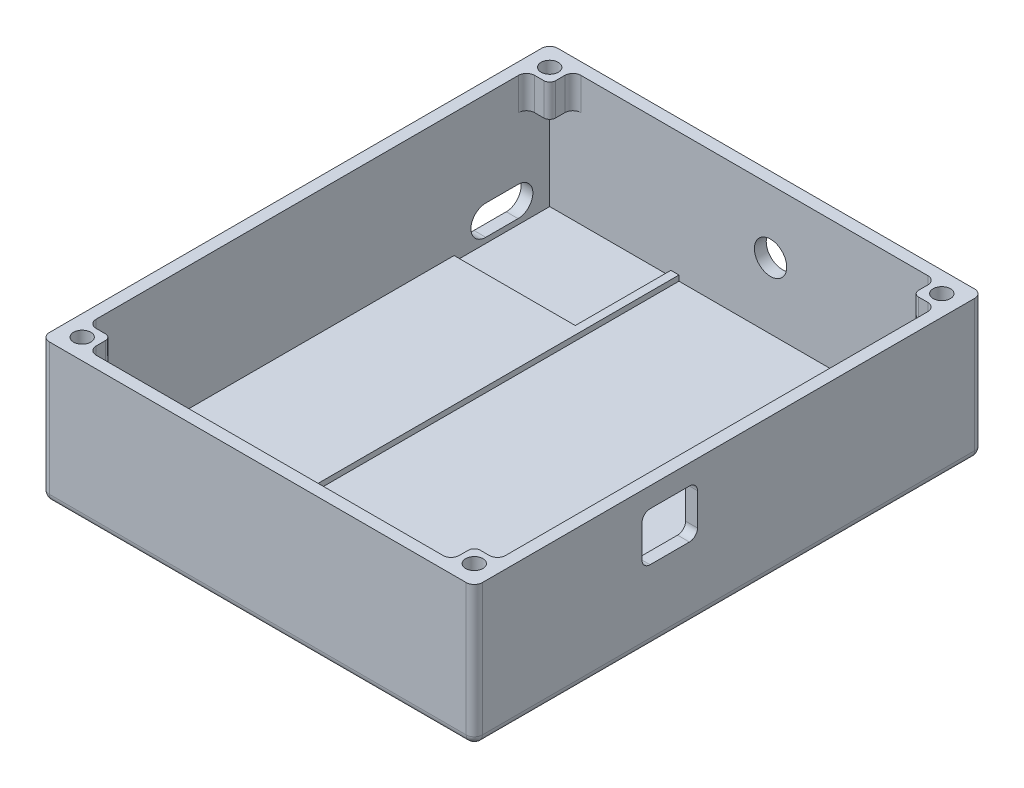
from build123d import *

# Parameters (mm, degrees)
SKETCH1_W           = 22.5
SKETCH1_H           = 17.75
SKETCH1_W_2         = 52
SKETCH1_H_2         = 71.85
BOSS_EXTRUDE1_DEPTH = 2
BOSS_EXTRUDE2_DEPTH = 3
SKETCH1_4_W         = 80.4
SKETCH1_4_H         = 94.4
SKETCH1_4_W_2       = 76
SKETCH1_4_H_2       = 90
BOSS_EXTRUDE3_DEPTH = 26
BOSS_EXTRUDE4_DEPTH = 78.2
CUT_EXTRUDE1_START  = -78.2
SKETCH2_3_W         = 10.3
SKETCH2_3_H         = 9
CUT_EXTRUDE1_DEPTH  = 26
CUT_EXTRUDE2_DEPTH  = 26
FILLET1_R           = 1.5
SKETCH4_R           = 3
CUT_EXTRUDE3_DEPTH  = 26
SKETCH5_R           = 1.6
BOSS_EXTRUDE5_DEPTH = 6
FILLET2_R           = 1.5


with BuildPart() as part:
    # Sketch1 → Boss-Extrude1 (new body)
    with BuildSketch(Plane(origin=(0, 0, 0), x_dir=(1, 0, 0), z_dir=(0, 1, 0))):
        Polygon((-38, -26.85), (-14, -26.85), (-14, 45), (-15.5, 45), (-15.5, 27.25), (-38, 27.25), align=None)
        with Locations((-26.75, 36.125)):
            Rectangle(SKETCH1_W, SKETCH1_H)
        with Locations((12, 9.075)):
            Rectangle(SKETCH1_W_2, SKETCH1_H_2)
        Polygon((38, -45), (38, -26.85), (-14, -26.85), (-38, -26.85), (-38, -45), align=None)
    extrude(amount=BOSS_EXTRUDE1_DEPTH)

    # Sketch1<3> → Boss-Extrude2 (add)
    with BuildSketch(Plane(origin=(0, 0, 0), x_dir=(1, 0, 0), z_dir=(0, 1, 0))):
        Polygon((-38, -26.85), (-14, -26.85), (-14, 45), (-15.5, 45), (-15.5, 27.25), (-38, 27.25), align=None)
    extrude(amount=BOSS_EXTRUDE2_DEPTH)

    # Sketch1<4> → Boss-Extrude3 (add)
    with BuildSketch(Plane(origin=(0, 0, 0), x_dir=(1, 0, 0), z_dir=(0, 1, 0))):
        Rectangle(SKETCH1_4_W, SKETCH1_4_H)
        Rectangle(SKETCH1_4_W_2, SKETCH1_4_H_2, mode=Mode.SUBTRACT)
    extrude(amount=BOSS_EXTRUDE3_DEPTH)

    # Sketch2 → Boss-Extrude4 (add)
    with BuildSketch(Plane.ZY.offset(40.2)):
        with BuildLine():
            Line((28.764343606, 5.5), (26.964343606, 5.5))
            Line((26.964343606, 5.5), (26.964343606, 0))
            Line((26.964343606, 0), (41.904953918, 0))
            Line((41.904953918, 0), (47.2, 0))
            Line((47.2, 0), (47.2, 5.5375))
            Line((47.2, 5.5375), (45, 5.5375))
            Line((45, 5.5375), (43.114695317, 5.5375))
            ThreePointArc((43.114695317, 5.5375), (35.948714495, 2.000030985), (28.764343606, 5.5))
        make_face()
    extrude(amount=-BOSS_EXTRUDE4_DEPTH)

    # Sketch2<3> → Cut-Extrude1 (cut)
    with BuildSketch(Plane.ZY.offset(40.2).offset(CUT_EXTRUDE1_START)):
        with Locations((10.914343606, 17.8)):
            Rectangle(SKETCH2_3_W, SKETCH2_3_H)
    extrude(amount=-CUT_EXTRUDE1_DEPTH, mode=Mode.SUBTRACT)

    # Sketch3 → Cut-Extrude2 (cut)
    with BuildSketch(Plane.ZY.offset(40.2)):
        with BuildLine():
            Line((-39.125, 8.5), (-33.125, 8.5))
            ThreePointArc((-33.125, 8.5), (-30.375, 5.75), (-33.125, 3))
            Line((-33.125, 3), (-39.125, 3))
            ThreePointArc((-39.125, 3), (-41.875, 5.75), (-39.125, 8.5))
        make_face()
    extrude(amount=-CUT_EXTRUDE2_DEPTH, mode=Mode.SUBTRACT)

    # Fillet1
    fillet1_edges = [part.edges().sort_by_distance(p)[0] for p in [
        (39.1, 22.3, 16.064343606),
        (39.1, 13.3, 16.064343606),
        (39.1, 13.3, 5.764343606),
        (39.1, 22.3, 5.764343606),
        (0, 0, 47.2),
        (-40.2, 13, 47.2),
        (40.2, 0, 0),
        (40.2, 13, 47.2),
        (40.2, 13, -47.2),
        (-40.2, 13, -47.2),
        (-40.2, 0, 0),
        (0, 0, -47.2),
    ]]
    fillet(fillet1_edges, radius=FILLET1_R)

    # Sketch4 → Cut-Extrude3 (cut)
    with BuildSketch(Plane(origin=(0, 0, -47.2), x_dir=(-1, 0, 0), z_dir=(0, 0, -1))):
        with Locations((-3, 14.26242493)):
            Circle(SKETCH4_R)
    extrude(amount=-CUT_EXTRUDE3_DEPTH, mode=Mode.SUBTRACT)

    # Sketch5 → Boss-Extrude5 (add)
    # profile 1 of 4: a face of its own
    with BuildSketch(Plane(origin=(0, 26, 0), x_dir=(1, 0, 0), z_dir=(0, 1, 0))):
        with BuildLine():
            Line((-33.7, 45), (-33.7, 41.8))
            ThreePointArc((-33.7, 41.8), (-34.022182541, 41.022182541), (-34.8, 40.7))
            Line((-34.8, 40.7), (-38, 40.7))
            Line((-38, 40.7), (-39.1, 40.7))
            Line((-39.1, 40.7), (-39.1, 46.1))
            Line((-39.1, 46.1), (-33.7, 46.1))
            Line((-33.7, 46.1), (-33.7, 45))
        make_face()
        with Locations(Location((-36.4, 43.4, 0), (0, 0, 270))):
            Circle(SKETCH5_R, mode=Mode.SUBTRACT)
    # profile 2 of 4: a face of its own
    with BuildSketch(Plane(origin=(0, 26, 0), x_dir=(1, 0, 0), z_dir=(0, 1, 0))):
        with BuildLine():
            Line((33.7, 46.1), (33.7, 45))
            Line((33.7, 45), (33.7, 41.8))
            ThreePointArc((33.7, 41.8), (34.022182541, 41.022182541), (34.8, 40.7))
            Line((34.8, 40.7), (38, 40.7))
            Line((38, 40.7), (39.1, 40.7))
            Line((39.1, 40.7), (39.1, 46.1))
            Line((39.1, 46.1), (33.7, 46.1))
        make_face()
        with Locations(Location((36.4, 43.4, 0), (0, 0, 90))):
            Circle(SKETCH5_R, mode=Mode.SUBTRACT)
    # profile 3 of 4: a face of its own
    with BuildSketch(Plane(origin=(0, 26, 0), x_dir=(1, 0, 0), z_dir=(0, 1, 0))):
        with BuildLine():
            Line((33.7, -45), (33.7, -41.8))
            ThreePointArc((33.7, -41.8), (34.022182541, -41.022182541), (34.8, -40.7))
            Line((34.8, -40.7), (38, -40.7))
            Line((38, -40.7), (39.1, -40.7))
            Line((39.1, -40.7), (39.1, -46.1))
            Line((39.1, -46.1), (33.7, -46.1))
            Line((33.7, -46.1), (33.7, -45))
        make_face()
        with Locations(Location((36.4, -43.4, 0), (0, 0, 270))):
            Circle(SKETCH5_R, mode=Mode.SUBTRACT)
    # profile 4 of 4: a face of its own
    with BuildSketch(Plane(origin=(0, 26, 0), x_dir=(1, 0, 0), z_dir=(0, 1, 0))):
        with BuildLine():
            Line((-33.7, -46.1), (-33.7, -45))
            Line((-33.7, -45), (-33.7, -41.8))
            ThreePointArc((-33.7, -41.8), (-34.022182541, -41.022182541), (-34.8, -40.7))
            Line((-34.8, -40.7), (-38, -40.7))
            Line((-38, -40.7), (-39.1, -40.7))
            Line((-39.1, -40.7), (-39.1, -46.1))
            Line((-39.1, -46.1), (-33.7, -46.1))
        make_face()
        with Locations(Location((-36.4, -43.4, 0), (0, 0, 270))):
            Circle(SKETCH5_R, mode=Mode.SUBTRACT)
    extrude(amount=-BOSS_EXTRUDE5_DEPTH)

    # Fillet2
    fillet2_edges = [part.edges().sort_by_distance(p)[0] for p in [
        (-33.7, 23, -45),
        (-38, 23, -40.7),
        (33.7, 23, -45),
        (38, 23, -40.7),
        (38, 23, 40.7),
        (33.7, 23, 45),
        (-33.7, 23, 45),
        (-38, 23, 40.7),
    ]]
    fillet(fillet2_edges, radius=FILLET2_R)


solid = part.part
